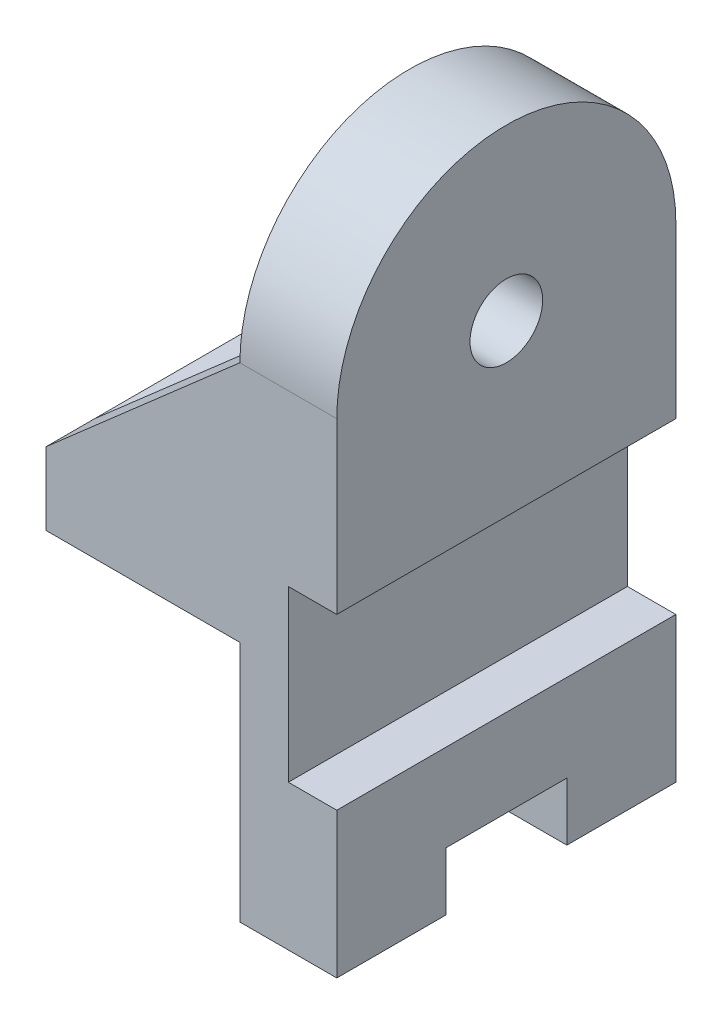
from build123d import *

# Parameters (mm, degrees)
EXTRUDE_1_DEPTH     = 20
SKETCH_2_W          = 10
SKETCH_2_H          = 35
CUT_EXTRUDE_1_DEPTH = 112.915146428
EXTRUDE_START       = -35
SKETCH_3_W          = 40
SKETCH_3_H          = 15
EXTRUDE_2_DEPTH     = 70
SKETCH_4_R          = 6
CUT_EXTRUDE_2_DEPTH = 110.772492001
EXTRUDE_3_DEPTH     = 10


with BuildPart() as part:
    # Эскиз1 → Бобышка-Вытянуть1 (new body)
    with BuildSketch(Plane(origin=(0, 0, 0), x_dir=(0, 0, -1), z_dir=(1, 0, 0))):
        with BuildLine():
            Line((-35, 50), (-35, -50))
            Line((-35, -50), (-12.5, -50))
            Line((-12.5, -50), (-12.5, -38))
            Line((-12.5, -38), (12.5, -38))
            Line((12.5, -38), (12.5, -50))
            Line((12.5, -50), (35, -50))
            Line((35, -50), (35, 50))
            ThreePointArc((35, 50), (0, 15), (-35, 50))
        make_face()
        with BuildLine():
            ThreePointArc((35, 50), (0, 85), (-35, 50))
            Line((-35, 50), (-7.5, 50))
            ThreePointArc((-7.5, 50), (0, 57.5), (7.5, 50))
            Line((7.5, 50), (35, 50))
        make_face()
        with BuildLine():
            Line((-7.5, 50), (-35, 50))
            ThreePointArc((-35, 50), (0, 15), (35, 50))
            Line((35, 50), (7.5, 50))
            ThreePointArc((7.5, 50), (0, 42.5), (-7.5, 50))
        make_face()
    extrude(amount=-EXTRUDE_1_DEPTH)

    # Эскиз2 → Вырез-Вытянуть1 (cut, through all)
    with BuildSketch(Plane(origin=(0, 0, -35), x_dir=(-1, 0, 0), z_dir=(0, 0, -1))):
        with Locations((5, -2.5)):
            Rectangle(SKETCH_2_W, SKETCH_2_H)
    extrude(amount=-CUT_EXTRUDE_1_DEPTH, mode=Mode.SUBTRACT)

    # Эскиз3 → Бобышка-Вытянуть2 (add)
    with BuildSketch(Plane.XY.offset(EXTRUDE_START)):
        with Locations((-40, 7.5)):
            Rectangle(SKETCH_3_W, SKETCH_3_H)
    extrude(amount=EXTRUDE_2_DEPTH)

    # Эскиз4 → Вырез-Вытянуть2 (cut, through all)
    with BuildSketch(Plane.XZ):
        with Locations((-40, 0)):
            Circle(SKETCH_4_R)
    extrude(amount=-CUT_EXTRUDE_2_DEPTH, mode=Mode.SUBTRACT)

    # Эскиз5 → Бобышка-Вытянуть3 (add)
    with BuildSketch(Plane.XY.offset(35)):
        Polygon((-60, 15), (-20, 50), (-20, 15), align=None)
    extrude_3 = extrude(amount=-EXTRUDE_3_DEPTH)

    # Зеркальное отражение1: Бобышка-Вытянуть3 across plane
    add(extrude_3.mirror(Plane.XY))


solid = part.part
